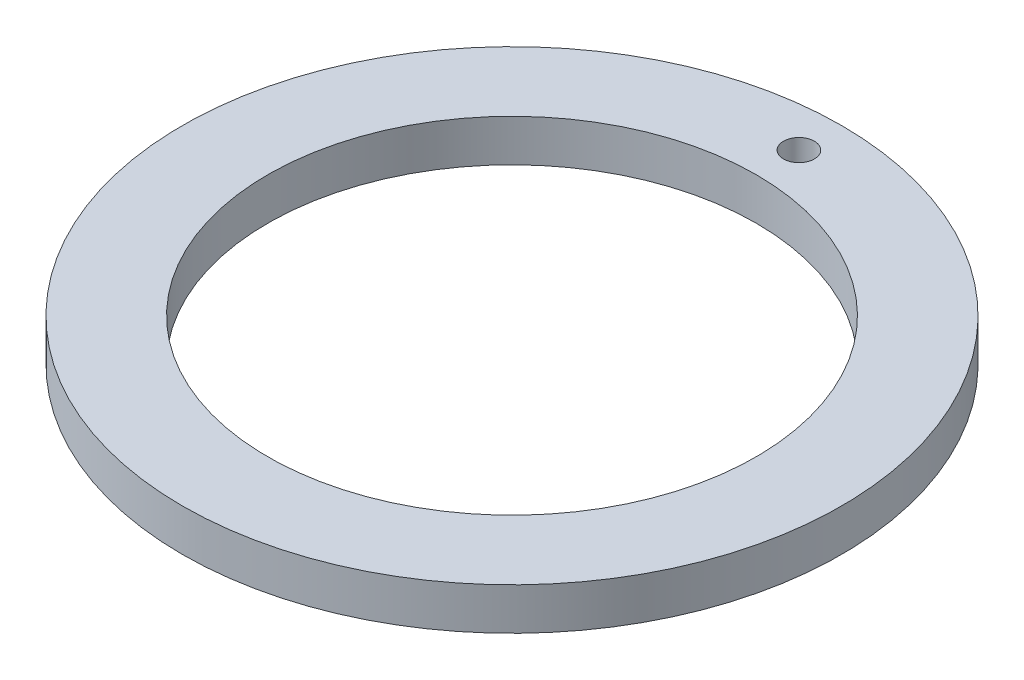
from build123d import *

# Parameters (mm, degrees)
SKETCH1_R           = 50.8
BOSS_EXTRUDE1_DEPTH = 6.477
SKETCH3_R           = 37.6555
CUT_EXTRUDE1_DEPTH  = 6.477
SKETCH4_R           = 2.38125
CUT_EXTRUDE2_DEPTH  = 6.477


with BuildPart() as part:
    # Sketch1 → Boss-Extrude1 (new body)
    with BuildSketch(Plane(origin=(0, 0, 0), x_dir=(1, 0, 0), z_dir=(0, 1, 0))):
        with Locations(Location((0, 0, 0), (0, 0, 270))):
            Circle(SKETCH1_R)
    extrude(amount=BOSS_EXTRUDE1_DEPTH)

    # Sketch3 → Cut-Extrude1 (cut)
    with BuildSketch(Plane(origin=(0, 0, 0), x_dir=(-1, 0, 0), z_dir=(0, -1, 0))):
        with Locations(Location((0, 0, 0), (0, 0, 90))):
            Circle(SKETCH3_R)
    extrude(amount=-CUT_EXTRUDE1_DEPTH, mode=Mode.SUBTRACT)

    # Sketch4 → Cut-Extrude2 (cut)
    with BuildSketch(Plane.XZ):
        with Locations(Location((0, -44.22775, 0), (0, 0, 270))):
            Circle(SKETCH4_R)
    extrude(amount=-CUT_EXTRUDE2_DEPTH, mode=Mode.SUBTRACT)


solid = part.part
